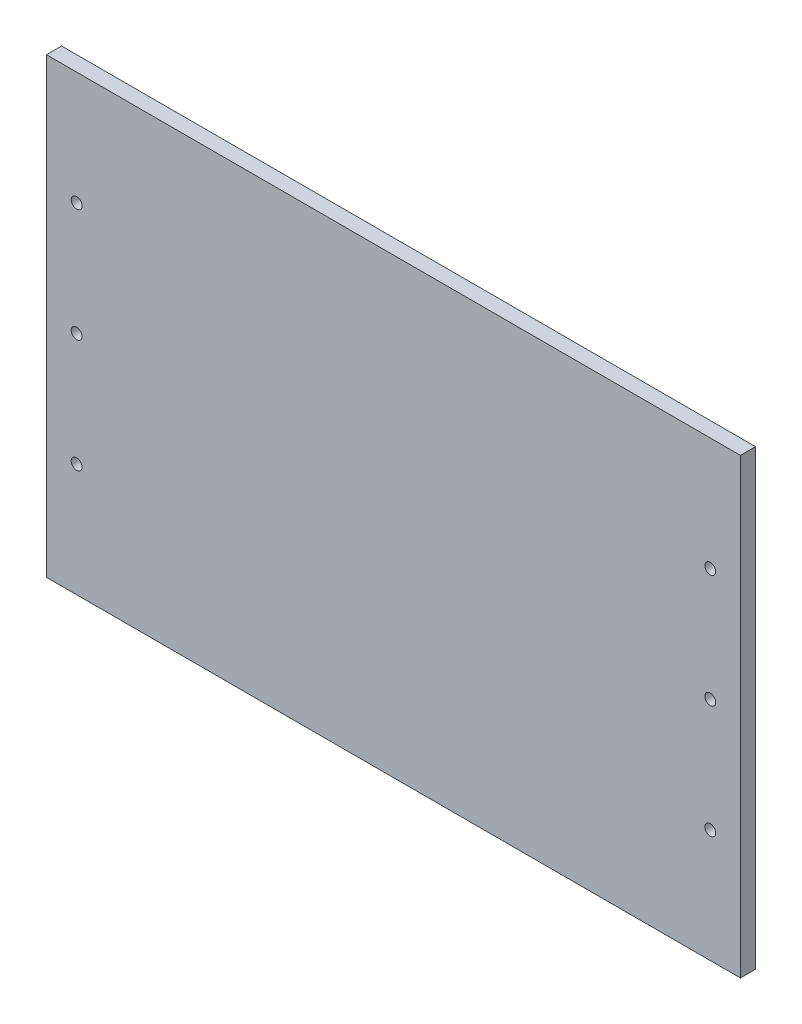
from build123d import *

# Parameters (mm, degrees)
SZKIC1_W                                          = 230
SZKIC1_H                                          = 150
DODANIE_WYCI_GNI_CIE1_DEPTH                       = 5
POG_BIENIE_WALCOWE_POD_M3_RUB_Z_BEM_S_D           = 3.6
POG_BIENIE_WALCOWE_POD_M3_RUB_Z_BEM_S_DEPTH       = 6.7
POG_BIENIE_WALCOWE_POD_M3_RUB_Z_BEM_S_CBORE_D     = 7
POG_BIENIE_WALCOWE_POD_M3_RUB_Z_BEM_S_CBORE_DEPTH = 2.4
POG_BIENIE_WALCOWE_POD_M3_RUB_Z_BEM_S_TIP         = 1.081549114


with BuildPart() as part:
    # Szkic1 → Dodanie-wyciągnięcie1 (new body)
    with BuildSketch(Plane.XY):
        Rectangle(SZKIC1_W, SZKIC1_H)
    extrude(amount=DODANIE_WYCI_GNI_CIE1_DEPTH)

    # Pogłębienie walcowe pod M3 Śrubę z łbem stożkowym ściętym1
    with Locations(Plane(origin=(0, 0, 0), x_dir=(-1, 0, 0), z_dir=(0, 0, -1))):
        with Locations((105, 37.5), (105, 0), (105, -37.5), (-105, -37.5), (-105, 0), (-105, 37.5)):
            CounterBoreHole(POG_BIENIE_WALCOWE_POD_M3_RUB_Z_BEM_S_D / 2, POG_BIENIE_WALCOWE_POD_M3_RUB_Z_BEM_S_CBORE_D / 2, POG_BIENIE_WALCOWE_POD_M3_RUB_Z_BEM_S_CBORE_DEPTH, depth=POG_BIENIE_WALCOWE_POD_M3_RUB_Z_BEM_S_DEPTH)
            with Locations((0, 0, -(POG_BIENIE_WALCOWE_POD_M3_RUB_Z_BEM_S_DEPTH + POG_BIENIE_WALCOWE_POD_M3_RUB_Z_BEM_S_TIP / 2))):  # 118° drill point
                Cone(0, POG_BIENIE_WALCOWE_POD_M3_RUB_Z_BEM_S_D / 2, POG_BIENIE_WALCOWE_POD_M3_RUB_Z_BEM_S_TIP, mode=Mode.SUBTRACT)


solid = part.part
